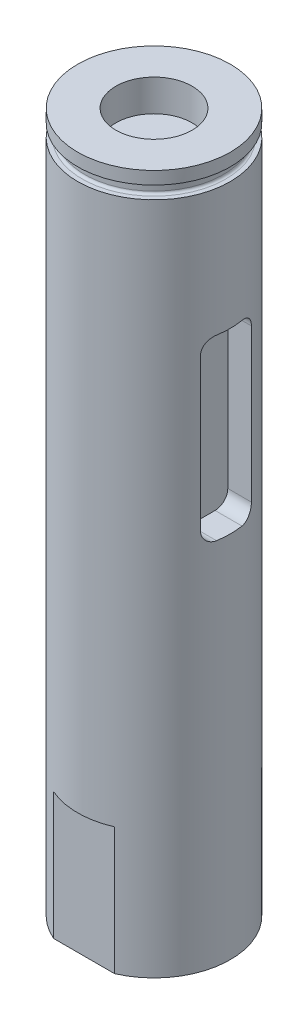
from build123d import *
from build123d.topology import SkipClean

# Parameters (mm, degrees)
BOSS_EXTRUDE1_DEPTH   = 14
SKETCH2_R             = 6
BOSS_EXTRUDE2_DEPTH   = 12
BOSS_EXTRUDE3_START   = 15
SKETCH3_R             = 6
BOSS_EXTRUDE3_DEPTH   = 15
CUT_EXTRUDE1_DEPTH    = 2.2
BOSS_EXTRUDE4_START   = 14
BOSS_EXTRUDE4_DEPTH   = 14
CUT_EXTRUDE2_DEPTH    = 10
SKETCH24_R            = 3
CUT_EXTRUDE3_DEPTH    = 2.5
M4_TAPPED_HOLE1_D     = 3.3
M4_TAPPED_HOLE1_DEPTH = 10
M4_TAPPED_HOLE1_TIP   = 0.991420021


with BuildPart() as part:
    # Sketch1 → Boss-Extrude1 (new body)
    with BuildSketch(Plane(origin=(0, 0, 0), x_dir=(1, 0, 0), z_dir=(0, 1, 0))):
        with BuildLine():
            ThreePointArc((5.656854249, 2), (-6, 0), (5.656854249, -2))
            ThreePointArc((5.656854249, -2), (6, 0), (5.656854249, 2))
        make_face()
    extrude(amount=BOSS_EXTRUDE1_DEPTH)

    # Sketch2 → Boss-Extrude2 (add)
    with BuildSketch(Plane(origin=(0, 14, 0), x_dir=(1, 0, 0), z_dir=(0, 1, 0))):
        with Locations(Location((0, 0, 0), (0, 0, 270))):
            Circle(SKETCH2_R)
    extrude(amount=BOSS_EXTRUDE2_DEPTH)

    # Sketch3 → Boss-Extrude3 (add)
    with BuildSketch(Plane.XZ.offset(BOSS_EXTRUDE3_START)):
        with Locations(Location((0, 0, 0), (0, 0, 270))):
            Circle(SKETCH3_R)
    extrude(amount=-BOSS_EXTRUDE3_DEPTH)

    # Groove Sketch → Retaining Ring Groove (revolve, cut)
    with BuildSketch(Plane(origin=(1.604252923, 12.182890291, 0.373259529), x_dir=(-0.9343262431877186, 0.2824476966643587, -0.2173885230174828), z_dir=(-0.2266157025474993, 0, 0.9739842521103221)), mode=Mode.PRIVATE) as retaining_ring_groove_sk:
        with BuildLine():
            Line((10.620148315, -10.234181518), (12.083054432, -9.80344878))
            Line((12.083054432, -9.80344878), (11.800606735, -8.84416608))
            Line((11.800606735, -8.84416608), (10.337700618, -9.274898818))
            ThreePointArc((10.337700618, -9.274898818), (10.21858296, -9.371036434), (10.202333617, -9.523244897))
            Line((10.202333617, -9.523244897), (10.371802235, -10.098814517))
            ThreePointArc((10.371802235, -10.098814517), (10.467939851, -10.217932175), (10.620148315, -10.234181518))
        make_face()
    revolve(retaining_ring_groove_sk.sketch.rotate(Axis((0, 60.224615576, 0), (0, -1, 0)), 76.902094509), axis=Axis((0, 60.224615576, 0), (0, -1, 0)), mode=Mode.SUBTRACT)

    # Sketch21 → Cut-Extrude1 (cut)
    with SkipClean():  # the faces are left unmerged after this step: merging them gives an invalid solid
        with BuildSketch(Plane(origin=(6, 0, 0), x_dir=(0, 0, -1), z_dir=(1, 0, 0))):
            with BuildLine():
                Line((-1, 14), (1, 14))
                ThreePointArc((1, 14), (1.707106781, 13.707106781), (2, 13))
                Line((2, 13), (2, 1))
                ThreePointArc((2, 1), (1.707106781, 0.292893219), (1, 0))
                Line((1, 0), (-1, 0))
                ThreePointArc((-1, 0), (-1.707106781, 0.292893219), (-2, 1))
                Line((-2, 1), (-2, 13))
                ThreePointArc((-2, 13), (-1.707106781, 13.707106781), (-1, 14))
            make_face()
        extrude(amount=-CUT_EXTRUDE1_DEPTH, mode=Mode.SUBTRACT)

    # Sketch22 → Boss-Extrude4 (add)
    with SkipClean():  # the faces are left unmerged after this step: merging them gives an invalid solid
        with BuildSketch(Plane.XZ.offset(15).offset(BOSS_EXTRUDE4_START)):
            with BuildLine():
                ThreePointArc((2.397915762, -5.5), (0, 6), (-2.397915762, -5.5))
                ThreePointArc((-2.397915762, -5.5), (0, -6), (2.397915762, -5.5))
            make_face()
        extrude(amount=-BOSS_EXTRUDE4_DEPTH)

    # Sketch23 → Cut-Extrude2 (cut)
    with SkipClean():  # the faces are left unmerged after this step: merging them gives an invalid solid
        with BuildSketch(Plane.XZ.offset(29)):
            with BuildLine():
                Line((-2.397915762, 5.5), (2.397915762, 5.5))
                ThreePointArc((2.397915762, 5.5), (0, 6), (-2.397915762, 5.5))
            make_face()
        extrude(amount=-CUT_EXTRUDE2_DEPTH, mode=Mode.SUBTRACT)

    # Sketch24 → Cut-Extrude3 (cut)
    with SkipClean():  # the faces are left unmerged after this step: merging them gives an invalid solid
        with BuildSketch(Plane(origin=(0, 26, 0), x_dir=(1, 0, 0), z_dir=(0, 1, 0))):
            with Locations(Location((0, 0, 0), (0, 0, 270))):
                Circle(SKETCH24_R)
        extrude(amount=-CUT_EXTRUDE3_DEPTH, mode=Mode.SUBTRACT)

    # M4 Tapped Hole1
    with Locations(Plane(origin=(0, -29, 0), x_dir=(-1, 0, 0), z_dir=(0, -1, 0))):
        with Locations((0, 0)):
            Hole(M4_TAPPED_HOLE1_D / 2, depth=M4_TAPPED_HOLE1_DEPTH)
            with Locations((0, 0, -(M4_TAPPED_HOLE1_DEPTH + M4_TAPPED_HOLE1_TIP / 2))):  # 118° drill point
                Cone(0, M4_TAPPED_HOLE1_D / 2, M4_TAPPED_HOLE1_TIP, mode=Mode.SUBTRACT)


solid = part.part
